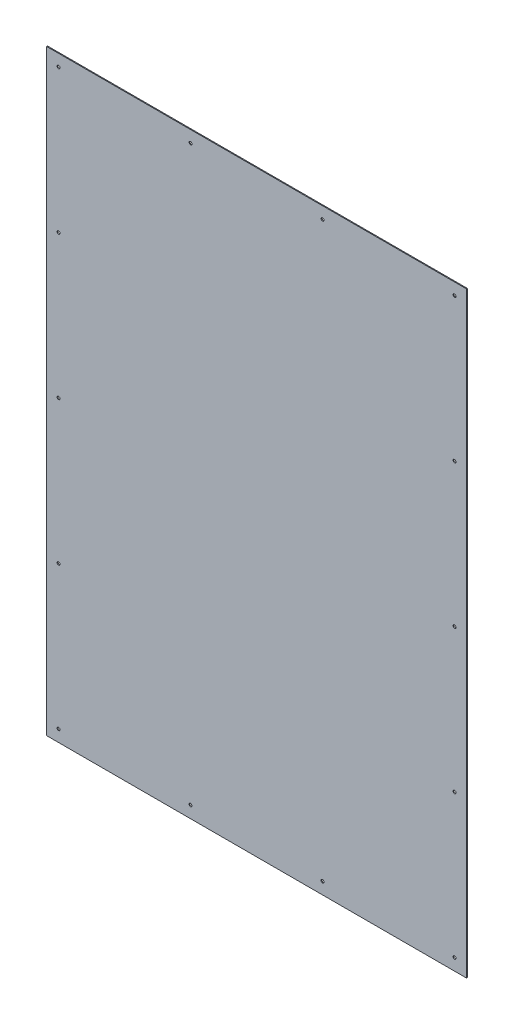
from build123d import *

# Parameters (mm, degrees)
CROQUIS1_W              = 900
CROQUIS1_H              = 1280
SALIENTE_EXTRUIR1_DEPTH = 1.9
CROQUIS2_R              = 3.175
CROQUIS2_R_2            = 3.15
CORTAR_EXTRUIR2_DEPTH   = 10


with BuildPart() as part:
    # Croquis1 → Saliente-Extruir1 (new body)
    with BuildSketch(Plane.XY):
        Rectangle(CROQUIS1_W, CROQUIS1_H)
    extrude(amount=SALIENTE_EXTRUIR1_DEPTH)

    # Croquis2 → Cortar-Extruir2 (cut)
    with BuildSketch(Plane.XY.offset(1.9)):
        with Locations((-424.6, 0)):
            Circle(CROQUIS2_R)
        with Locations((-424.6, 614.6)):
            Circle(CROQUIS2_R_2)
        with Locations((424.6, 614.6)):
            Circle(CROQUIS2_R)
        with Locations((-141.54, 614.6)):
            Circle(CROQUIS2_R_2)
        with Locations((141.52, 614.6)):
            Circle(CROQUIS2_R_2)
        with Locations((-424.6, 307.3)):
            Circle(CROQUIS2_R)
        with Locations((-424.6, -307.3)):
            Circle(CROQUIS2_R)
        with Locations((424.6, -307.3)):
            Circle(CROQUIS2_R)
        with Locations((424.6, 0)):
            Circle(CROQUIS2_R)
        with Locations((424.6, 307.3)):
            Circle(CROQUIS2_R)
        with Locations((141.52, -614.6)):
            Circle(CROQUIS2_R_2)
        with Locations((-141.54, -614.6)):
            Circle(CROQUIS2_R_2)
        with Locations((424.6, -614.6)):
            Circle(CROQUIS2_R)
        with Locations((-424.6, -614.6)):
            Circle(CROQUIS2_R_2)
    extrude(amount=-CORTAR_EXTRUIR2_DEPTH, mode=Mode.SUBTRACT)


solid = part.part
